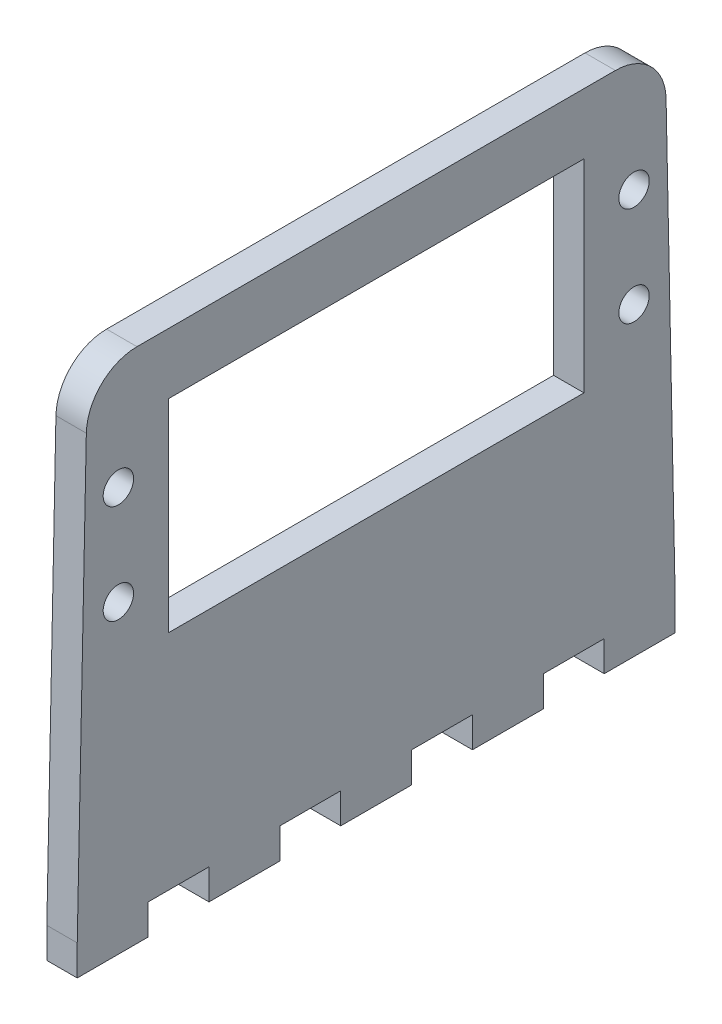
from build123d import *

# Parameters (mm, degrees)
SKETCH1_R           = 1.5
SKETCH1_W           = 41
SKETCH1_H           = 20
BOSS_EXTRUDE1_DEPTH = 3
FILLET1_R           = 5


with BuildPart() as part:
    # Sketch1 → Boss-Extrude1 (new body)
    with BuildSketch(Plane(origin=(0, 0, 0), x_dir=(0, 0, -1), z_dir=(1, 0, 0))):
        Polygon((-33, 0), (-32, 48), (25, 48), (26, 0), (26, -3), (19, -3), (19, 0), (13, 0), (13, -3), (6, -3), (6, 0), (0, 0), (0, -3), (-7, -3), (-7, 0), (-13, 0), (-13, -3), (-20, -3), (-20, 0), (-26, 0), (-26, -3), (-33, -3), align=None)
        with Locations((21.94, 36.9)):
            Circle(SKETCH1_R, mode=Mode.SUBTRACT)
        with Locations(Location((21.94, 27.1, 0), (0, 0, 180))):
            Circle(SKETCH1_R, mode=Mode.SUBTRACT)
        with Locations(Location((-28.94, 36.9, 0), (0, 0, 180))):
            Circle(SKETCH1_R, mode=Mode.SUBTRACT)
        with Locations((-28.94, 27.1)):
            Circle(SKETCH1_R, mode=Mode.SUBTRACT)
        with Locations((-3.5, 32)):
            Rectangle(SKETCH1_W, SKETCH1_H, mode=Mode.SUBTRACT)
    extrude(amount=BOSS_EXTRUDE1_DEPTH)

    # Fillet1
    fillet1_edges = [part.edges().sort_by_distance(p)[0] for p in [
        (1.5, 48, 32),
        (1.5, 48, -25),
    ]]
    fillet(fillet1_edges, radius=FILLET1_R)


solid = part.part
